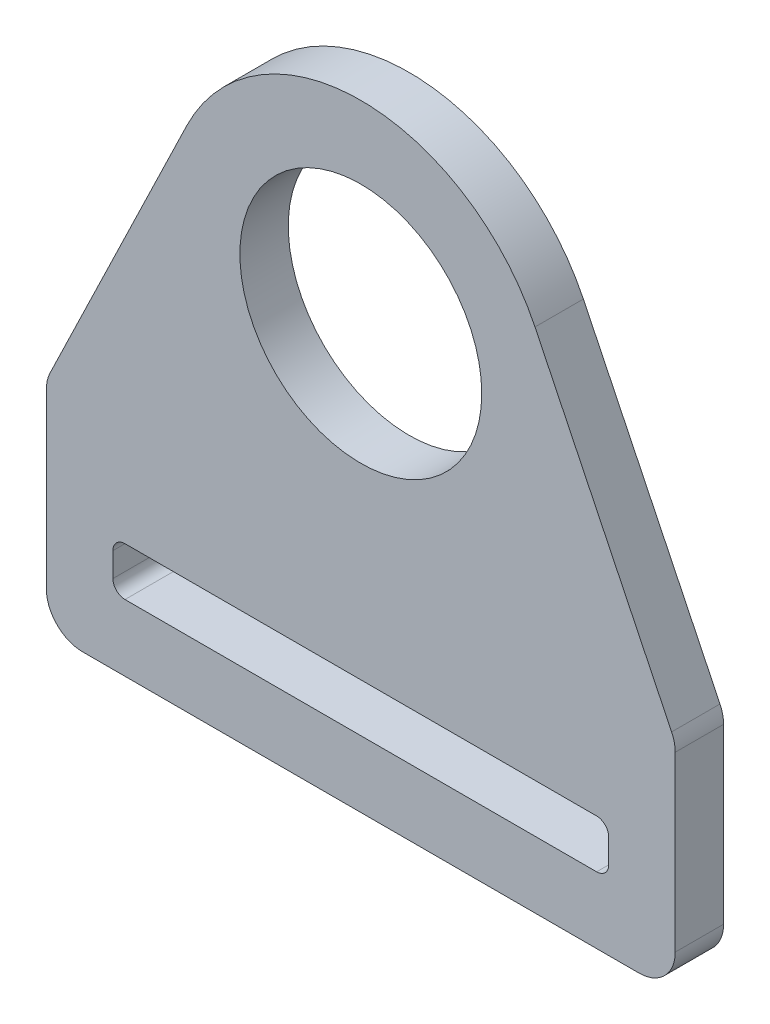
from build123d import *

# Parameters (mm, degrees)
SKETCH_1_R      = 10
SKETCH_1_W      = 41
SKETCH_1_H      = 4
EXTRUDE_1_DEPTH = 4
FILLET_3_R      = 3
FILLET_5_R      = 1


with BuildPart() as part:
    # Эскиз1 → Бобышка-Вытянуть1 (new body)
    with BuildSketch(Plane.XY):
        with BuildLine():
            Line((-26, -35), (26, -35))
            Line((26, -35), (26, -17))
            Line((26, -17), (14.402651465, 6.968761064))
            ThreePointArc((14.402651465, 6.968761064), (0, 16), (-14.402651465, 6.968761064))
            Line((-14.402651465, 6.968761064), (-26, -17))
            Line((-26, -17), (-26, -35))
        make_face()
        Circle(SKETCH_1_R, mode=Mode.SUBTRACT)
        with Locations((0, -27.5)):
            Rectangle(SKETCH_1_W, SKETCH_1_H, mode=Mode.SUBTRACT)
    extrude(amount=EXTRUDE_1_DEPTH)

    # Скругление3
    fillet_3_edges = [part.edges().sort_by_distance(p)[0] for p in [
        (-26, -35, 2),
        (-26, -17, 2),
        (26, -17, 2),
        (26, -35, 2),
    ]]
    fillet(fillet_3_edges, radius=FILLET_3_R)

    # Скругление5
    fillet_5_edges = [part.edges().sort_by_distance(p)[0] for p in [
        (-20.5, -25.5, 2),
        (-20.5, -29.5, 2),
        (20.5, -29.5, 2),
        (20.5, -25.5, 2),
    ]]
    fillet(fillet_5_edges, radius=FILLET_5_R)


solid = part.part
